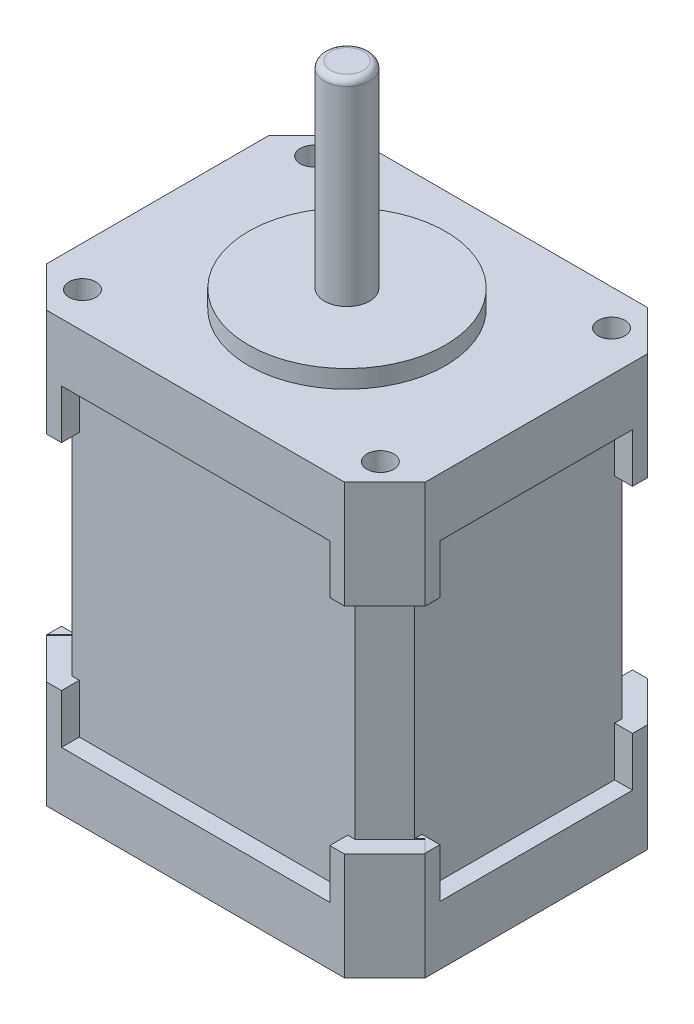
from build123d import *

# Parameters (mm, degrees)
SKETCH1_W           = 42.3
SKETCH1_H           = 33.84
BOSS_EXTRUDE1_DEPTH = 48
SKETCH2_R           = 11.009712126
BOSS_EXTRUDE2_DEPTH = 2
CHAMFER1_SIZE       = 4.5
CHAMFER2_SIZE       = 4.5
CHAMFER3_SIZE       = 4.5
CHAMFER4_SIZE       = 4.5
SKETCH3_R           = 2.52352428
BOSS_EXTRUDE3_DEPTH = 22
SKETCH4_R           = 1.5
CUT_EXTRUDE1_DEPTH  = 4.5
FILLET4_R           = 0.7
SKETCH5_W           = 30
SKETCH5_H           = 35
SKETCH5_W_2         = 1.65
SKETCH5_H_2         = 24
CUT_EXTRUDE2_DEPTH  = 2
SKETCH6_W           = 6.363961031
SKETCH6_H           = 24
CUT_EXTRUDE4_DEPTH  = 2
SKETCH8_W           = 21.54
SKETCH8_H           = 5.5
SKETCH8_H_2         = 23.916619391
SKETCH8_W_2         = 1.65
CUT_EXTRUDE5_DEPTH  = 2
SKETCH9_W           = 6.363961031
SKETCH9_H           = 23.916619391
CUT_EXTRUDE7_DEPTH  = 2
SKETCH10_W          = 33.3
SKETCH10_H          = 23.916619391
CUT_EXTRUDE8_DEPTH  = 2
SKETCH11_W          = 30
SKETCH11_H          = 35
CUT_EXTRUDE10_DEPTH = 2
SKETCH12_W          = 6.363961031
SKETCH12_H          = 23.916619391
CUT_EXTRUDE11_DEPTH = 2
SKETCH13_W          = 6.363961031
SKETCH13_H          = 24
CUT_EXTRUDE12_DEPTH = 2
SKETCH14_W          = 21.54
SKETCH14_H          = 5.5
SKETCH14_H_2        = 23.916619391
SKETCH14_H_3        = 5.583380609
SKETCH14_W_2        = 1.65
CUT_EXTRUDE13_DEPTH = 2


with BuildPart() as part:
    # Sketch1 → Boss-Extrude1 (new body)
    with BuildSketch(Plane(origin=(0, 0, 0), x_dir=(1, 0, 0), z_dir=(0, 1, 0))):
        Rectangle(SKETCH1_W, SKETCH1_H)
    extrude(amount=BOSS_EXTRUDE1_DEPTH)

    # Sketch2 → Boss-Extrude2 (add)
    with BuildSketch(Plane(origin=(0, 48, 0), x_dir=(1, 0, 0), z_dir=(0, 1, 0))):
        with Locations(Location((0, 0, 0), (0, 0, 270))):
            Circle(SKETCH2_R)
    extrude(amount=BOSS_EXTRUDE2_DEPTH)

    # Chamfer1
    chamfer1_edges = [part.edges().sort_by_distance(p)[0] for p in [
        (21.15, 24, 16.92),
    ]]
    chamfer(chamfer1_edges, length=CHAMFER1_SIZE)

    # Chamfer2
    chamfer2_edges = [part.edges().sort_by_distance(p)[0] for p in [
        (-21.15, 24, 16.92),
    ]]
    chamfer(chamfer2_edges, length=CHAMFER2_SIZE)

    # Chamfer3
    chamfer3_edges = [part.edges().sort_by_distance(p)[0] for p in [
        (21.15, 24, -16.92),
    ]]
    chamfer(chamfer3_edges, length=CHAMFER3_SIZE)

    # Chamfer4
    chamfer4_edges = [part.edges().sort_by_distance(p)[0] for p in [
        (-21.15, 24, -16.92),
    ]]
    chamfer(chamfer4_edges, length=CHAMFER4_SIZE)

    # Sketch3 → Boss-Extrude3 (add)
    with BuildSketch(Plane(origin=(0, 50, 0), x_dir=(1, 0, 0), z_dir=(0, 1, 0))):
        with Locations(Location((0, 0, 0), (0, 0, 270))):
            Circle(SKETCH3_R)
    extrude(amount=BOSS_EXTRUDE3_DEPTH)

    # Sketch4 → Cut-Extrude1 (cut)
    with BuildSketch(Plane(origin=(0, 48, 0), x_dir=(1, 0, 0), z_dir=(0, 1, 0))):
        with Locations(Location((-16.65, -12.923571429, 0), (0, 0, 270))):
            Circle(SKETCH4_R)
        with Locations(Location((-16.65, 12.923571429, 0), (0, 0, 270))):
            Circle(SKETCH4_R)
        with Locations(Location((16.65, 12.923571429, 0), (0, 0, 270))):
            Circle(SKETCH4_R)
        with Locations(Location((16.65, -12.923571429, 0), (0, 0, 270))):
            Circle(SKETCH4_R)
    extrude(amount=-CUT_EXTRUDE1_DEPTH, mode=Mode.SUBTRACT)

    # Fillet4
    fillet4_edges = [part.edges().sort_by_distance(p)[0] for p in [
        (0, 72, -2.52352428),
    ]]
    fillet(fillet4_edges, radius=FILLET4_R)

    # Sketch5 → Cut-Extrude2 (cut)
    with BuildSketch(Plane.XY.offset(16.92)):
        with Locations((0, 24)):
            Rectangle(SKETCH5_W, SKETCH5_H)
        with Locations((15.825, 24)):
            Rectangle(SKETCH5_W_2, SKETCH5_H_2)
        with Locations((-15.825, 24)):
            Rectangle(SKETCH5_W_2, SKETCH5_H_2)
    extrude(amount=-CUT_EXTRUDE2_DEPTH, mode=Mode.SUBTRACT)

    # Sketch6 → Cut-Extrude4 (cut)
    with BuildSketch(Plane(origin=(16.785, 0, 16.785), x_dir=(0.707106781186549, 0, -0.707106781186546), z_dir=(0.707106781186546, 0, 0.707106781186549))):
        with Locations((2.991061684, 24)):
            Rectangle(SKETCH6_W, SKETCH6_H)
    extrude(amount=-CUT_EXTRUDE4_DEPTH, mode=Mode.SUBTRACT)

    # Sketch8 → Cut-Extrude5 (cut)
    with BuildSketch(Plane(origin=(21.15, 0, 0), x_dir=(0, 0, -1), z_dir=(1, 0, 0))):
        with Locations((0, 38.75)):
            Rectangle(SKETCH8_W, SKETCH8_H)
        with Locations((0, 24.041690305)):
            Rectangle(SKETCH8_W, SKETCH8_H_2)
        with Locations((0, 9.333380609)):
            Rectangle(SKETCH8_W, SKETCH8_H)
        with Locations((11.595, 24.041690305)):
            Rectangle(SKETCH8_W_2, SKETCH8_H_2)
        with Locations((-11.595, 24.041690305)):
            Rectangle(SKETCH8_W_2, SKETCH8_H_2)
    extrude(amount=-CUT_EXTRUDE5_DEPTH, mode=Mode.SUBTRACT)

    # Sketch9 → Cut-Extrude7 (cut)
    with BuildSketch(Plane(origin=(16.785, 0, -16.785), x_dir=(-0.707106781186546, 0, -0.7071067811865491), z_dir=(0.7071067811865491, 0, -0.707106781186546))):
        with Locations((-2.991061684, 24.041690305)):
            Rectangle(SKETCH9_W, SKETCH9_H)
    extrude(amount=-CUT_EXTRUDE7_DEPTH, mode=Mode.SUBTRACT)

    # Sketch10 → Cut-Extrude8 (cut)
    with BuildSketch(Plane(origin=(0, 0, -16.92), x_dir=(-1, 0, 0), z_dir=(0, 0, -1))):
        with Locations((0, 24.041690305)):
            Rectangle(SKETCH10_W, SKETCH10_H)
    extrude(amount=-CUT_EXTRUDE8_DEPTH, mode=Mode.SUBTRACT)

    # Sketch11 → Cut-Extrude10 (cut)
    with BuildSketch(Plane(origin=(0, 0, -16.92), x_dir=(-1, 0, 0), z_dir=(0, 0, -1))):
        with Locations((0, 24)):
            Rectangle(SKETCH11_W, SKETCH11_H)
    extrude(amount=-CUT_EXTRUDE10_DEPTH, mode=Mode.SUBTRACT)

    # Sketch12 → Cut-Extrude11 (cut)
    with BuildSketch(Plane(origin=(-16.785, 0, -16.785), x_dir=(-0.7071067811865491, 0, 0.707106781186546), z_dir=(-0.707106781186546, 0, -0.7071067811865491))):
        with Locations((2.991061684, 24.041690305)):
            Rectangle(SKETCH12_W, SKETCH12_H)
    extrude(amount=-CUT_EXTRUDE11_DEPTH, mode=Mode.SUBTRACT)

    # Sketch13 → Cut-Extrude12 (cut)
    with BuildSketch(Plane(origin=(-16.785, 0, 16.785), x_dir=(0.7071067811865465, 0, 0.7071067811865486), z_dir=(-0.7071067811865486, 0, 0.7071067811865465))):
        with Locations((-2.991061684, 24)):
            Rectangle(SKETCH13_W, SKETCH13_H)
    extrude(amount=-CUT_EXTRUDE12_DEPTH, mode=Mode.SUBTRACT)

    # Sketch14 → Cut-Extrude13 (cut)
    with BuildSketch(Plane.ZY.offset(21.15)):
        with Locations((0, 38.75)):
            Rectangle(SKETCH14_W, SKETCH14_H)
        with Locations((0, 24.041690305)):
            Rectangle(SKETCH14_W, SKETCH14_H_2)
        with Locations((0, 9.291690305)):
            Rectangle(SKETCH14_W, SKETCH14_H_3)
        with Locations((11.595, 24.041690305)):
            Rectangle(SKETCH14_W_2, SKETCH14_H_2)
        with Locations((-11.595, 24.041690305)):
            Rectangle(SKETCH14_W_2, SKETCH14_H_2)
    extrude(amount=-CUT_EXTRUDE13_DEPTH, mode=Mode.SUBTRACT)


solid = part.part
